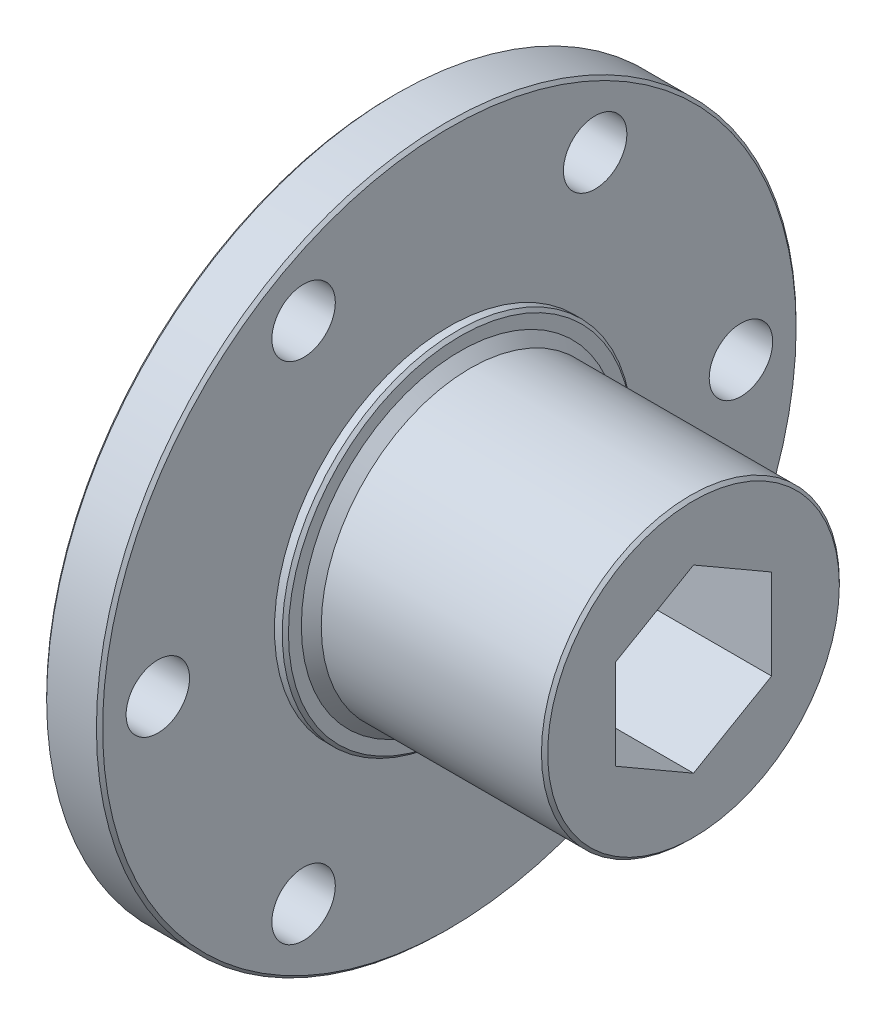
from build123d import *

# Parameters (mm, degrees)
SKETCH1_W                      = 4.572
SKETCH1_H                      = 28.575
SKETCH2_R                      = 14.2875
BOSS_EXTRUDE1_DEPTH            = 0.889
BOSS_EXTRUDE2_START            = 0.889
SKETCH3_R                      = 14.2875
BOSS_EXTRUDE2_DEPTH            = 0.889
SKETCH4_R                      = 12.9794
BOSS_EXTRUDE3_DEPTH            = 0.8128
BOSS_EXTRUDE3_TAPER            = 45
SKETCH5_R                      = 12.1666
BOSS_EXTRUDE4_DEPTH            = 18.2372
CUT_EXTRUDE1_DEPTH             = 48.730716001
F_6_0_204_DIAMETER_HOLE1_D     = 5.1816
F_6_0_204_DIAMETER_HOLE1_DEPTH = 24.511
CHAMFER1_SIZE                  = 0.254


with BuildPart() as part:
    # Sketch1 → Revolve1 (revolve)
    with BuildSketch(Plane(origin=(0, 0, 0), x_dir=(-1, 0, 0), z_dir=(0, 0, -1))):
        with Locations((16.210066246, 14.2875)):
            Rectangle(SKETCH1_W, SKETCH1_H)
    revolve(axis=Axis((-13.924066246, 0, 0), (-1, 0, 0)))

    # Sketch2 → Boss-Extrude1 (add)
    with BuildSketch(Plane.ZY.offset(18.496066246)):
        Circle(SKETCH2_R)
    extrude(amount=BOSS_EXTRUDE1_DEPTH)

    # Sketch3 → Boss-Extrude2 (add)
    with BuildSketch(Plane(origin=(-13.924066246, 0, 0), x_dir=(0, 0, -1), z_dir=(1, 0, 0)).offset(BOSS_EXTRUDE2_START)):
        Circle(SKETCH3_R)
    extrude(amount=-BOSS_EXTRUDE2_DEPTH)

    # Sketch4 → Boss-Extrude3 (add)
    with BuildSketch(Plane(origin=(-13.035066246, 0, 0), x_dir=(0, 0, -1), z_dir=(1, 0, 0))):
        Circle(SKETCH4_R)
    extrude(amount=BOSS_EXTRUDE3_DEPTH, taper=BOSS_EXTRUDE3_TAPER)

    # Sketch5 → Boss-Extrude4 (add)
    with BuildSketch(Plane(origin=(-12.222266246, 0, 0), x_dir=(0, 0, -1), z_dir=(1, 0, 0))):
        Circle(SKETCH5_R)
    extrude(amount=BOSS_EXTRUDE4_DEPTH)

    # Sketch6 → Cut-Extrude1 (cut, through all)
    with BuildSketch(Plane(origin=(6.014933754, 0, 0), x_dir=(0, 0, -1), z_dir=(1, 0, 0))):
        Polygon((0, -7.361697812), (6.3754, -3.680858906), (6.3754, 3.680818906), (0, 7.361657812), (-6.3754, 3.680818906), (-6.3754, -3.680858906), align=None)
    extrude(amount=-CUT_EXTRUDE1_DEPTH, mode=Mode.SUBTRACT)

    # #6 (0.204) Diameter Hole1
    with Locations(Plane.ZY.offset(18.496066246)):
        with Locations((11.90625, -20.622229928), (-11.90625, -20.622229928), (-23.8125, 0), (-11.90625, 20.622229928), (11.90625, 20.622229928), (23.8125, 0)):
            Hole(F_6_0_204_DIAMETER_HOLE1_D / 2, depth=F_6_0_204_DIAMETER_HOLE1_DEPTH)

    # Chamfer1
    chamfer1_edges = [part.edges().sort_by_distance(p)[0] for p in [
        (-13.035066246, 0, 14.2875),
        (6.014933754, 0, 12.1666),
        (-19.385066246, 0, -14.2875),
        (-13.924066246, -28.575, 0),
        (-18.496066246, -28.575, 0),
    ]]
    chamfer(chamfer1_edges, length=CHAMFER1_SIZE)


solid = part.part
